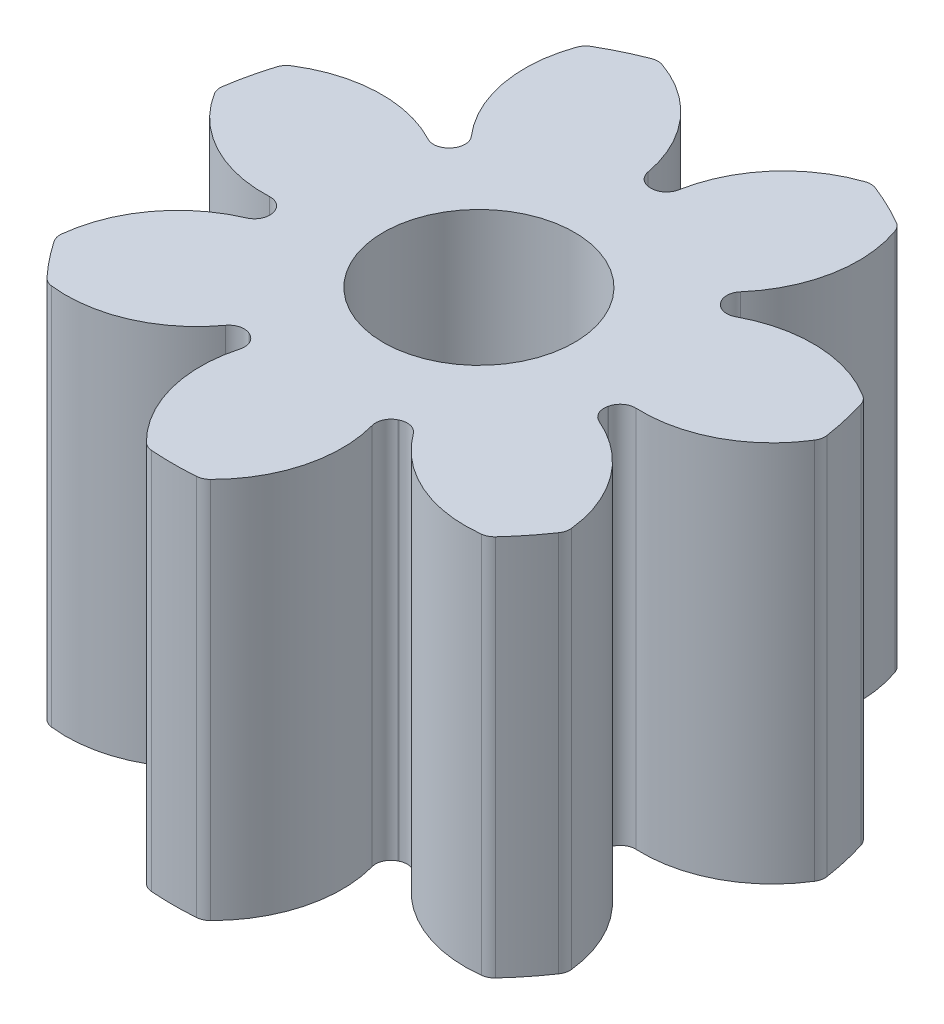
from build123d import *

# Parameters (mm, degrees)
SKETCH1_R           = 2
SKETCH1_R_2         = 0.625
BOSS_EXTRUDE1_DEPTH = 2.5
CUT_EXTRUDE1_DEPTH  = 4.774917218
CIRPATTERN1_COUNT   = 7
FILLET1_R           = 0.1


with BuildPart() as part:
    # Sketch1 → Boss-Extrude1 (new body)
    with BuildSketch(Plane(origin=(0, 0, 0), x_dir=(1, 0, 0), z_dir=(0, 1, 0))):
        with Locations(Location((0, 0, 0), (0, 0, 270))):
            Circle(SKETCH1_R)
        with Locations(Location((0, 0, 0), (0, 0, 270))):
            Circle(SKETCH1_R_2, mode=Mode.SUBTRACT)
    extrude(amount=BOSS_EXTRUDE1_DEPTH)

    # Sketch2 → Cut-Extrude1 (cut, through all)
    with BuildSketch(Plane(origin=(0, 2.5, 0), x_dir=(1, 0, 0), z_dir=(0, 1, 0))):
        with BuildLine():
            ThreePointArc((-0.69960378, 1.873647393), (-0.277874616, 1.59218497), (-0.089548631, 1.121430356))
            ThreePointArc((-0.089548631, 1.121430356), (0, 1.125), (0.089548631, 1.121430356))
            ThreePointArc((0.089548631, 1.121430356), (0.277874616, 1.59218497), (0.69960378, 1.873647393))
            ThreePointArc((0.69960378, 1.873647393), (0, 2), (-0.69960378, 1.873647393))
        make_face()
    cut_extrude1 = extrude(amount=-CUT_EXTRUDE1_DEPTH, mode=Mode.SUBTRACT)

    # CirPattern1: Cut-Extrude1 ×7 about axis
    cirpattern1_axis = Axis((0, 0, 0), (0, 1, 0))
    for i in range(1, CIRPATTERN1_COUNT):
        add(cut_extrude1.rotate(cirpattern1_axis, i * 360 / CIRPATTERN1_COUNT), mode=Mode.SUBTRACT)

    # Fillet1
    fillet1_edges = [part.edges().sort_by_distance(p)[0] for p in [
        (-0.69960378, 1.25, -1.873647393),
        (0.69960378, 1.25, -1.873647393),
        (0.089548631, 1.25, -1.121430356),
        (-0.089548631, 1.25, -1.121430356),
        (-1.90107234, 1.25, -0.621227781),
        (-1.028680697, 1.25, -1.715172302),
        (-0.820936899, 1.25, -0.769212329),
        (-0.932602216, 1.25, -0.629188451),
        (-0.182623911, 1.25, 1.991644674),
        (-1.443266362, 1.25, 1.384551266),
        (-0.567250925, 1.25, 0.971520143),
        (-0.405889867, 1.25, 1.049227533),
        (-1.670994654, 1.25, 1.09898902),
        (-1.982347627, 1.25, -0.265137484),
        (-1.1132402, 1.25, 0.16223827),
        (-1.07338731, 1.25, 0.33684519),
        (1.982347627, 1.25, -0.265137484),
        (1.670994654, 1.25, 1.09898902),
        (1.07338731, 1.25, 0.33684519),
        (1.1132402, 1.25, 0.16223827),
        (1.443266362, 1.25, 1.384551266),
        (0.182623911, 1.25, 1.991644674),
        (0.405889867, 1.25, 1.049227533),
        (0.567250925, 1.25, 0.971520143),
        (1.028680697, 1.25, -1.715172302),
        (1.90107234, 1.25, -0.621227781),
        (0.932602216, 1.25, -0.629188451),
        (0.820936899, 1.25, -0.769212329),
    ]]
    fillet(fillet1_edges, radius=FILLET1_R)


solid = part.part
